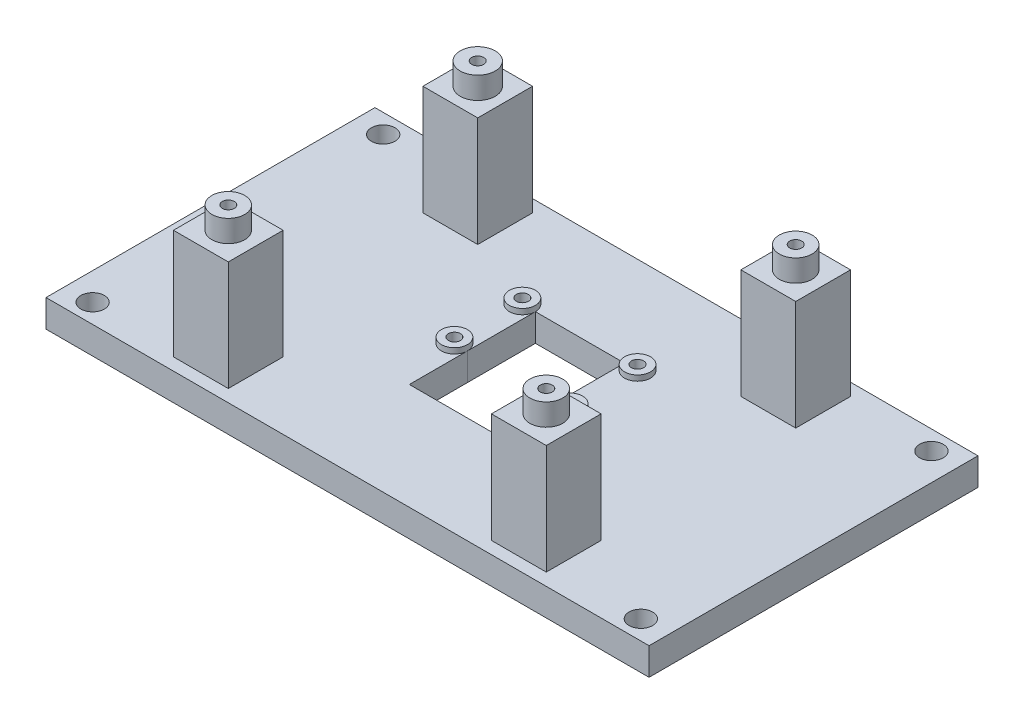
from build123d import *
from build123d.topology import SkipClean

# Parameters (mm, degrees)
ESQUISSE1_W             = 110
ESQUISSE1_H             = 60
BOSS_EXTRU_2_DEPTH      = 5
BOSS_EXTRU_3_START      = 1
ESQUISSE3_R             = 2.375
ESQUISSE3_R_2           = 1.1
BOSS_EXTRU_3_DEPTH      = 1
ESQUISSE4_W             = 5
ESQUISSE4_H             = 5
ESQUISSE4_W_2           = 10
ESQUISSE4_H_2           = 10
BOSS_EXTRU_4_DEPTH      = 20
ENL_V_MAT_EXTRU_5_DEPTH = 11
BOSS_EXTRU_5_START      = 4
BOSS_EXTRU_5_DEPTH      = 4
ENL_V_MAT_EXTRU_6_DEPTH = 10


with BuildPart() as part:
    # Esquisse1 → Boss.-Extru.2 (new body)
    # profile 1 of 22: a face of its own
    with BuildSketch(Plane(origin=(0, 0, 0), x_dir=(1, 0, 0), z_dir=(0, 1, 0))):
        Rectangle(ESQUISSE1_W, ESQUISSE1_H)
        with BuildLine():
            Line((-10.5, 2.375), (-10.5, 6.25))
            Line((-10.5, 6.25), (-10.5, 10.025))
            ThreePointArc((-10.5, 10.025), (-11.41471017, 10.208212988), (-12.188294627, 10.729585006))
            ThreePointArc((-12.188294627, 10.729585006), (-12.170414994, 14.088294627), (-8.811705373, 14.070414994))
            ThreePointArc((-8.811705373, 14.070414994), (-8.303374777, 13.303029695), (-8.125, 12.4))
            Line((-8.125, 12.4), (8.125, 12.4))
            ThreePointArc((8.125, 12.4), (8.345504143, 13.399386113), (8.966071665, 14.213198517))
            ThreePointArc((8.966071665, 14.213198517), (11.499386113, 14.554495857), (12.875, 12.4))
            ThreePointArc((12.875, 12.4), (12.654495857, 11.400613887), (12.033928335, 10.586801483))
            ThreePointArc((12.033928335, 10.586801483), (11.316785933, 10.169868672), (10.5, 10.025))
            Line((10.5, 10.025), (10.5, 2.375))
            ThreePointArc((10.5, 2.375), (11.368284246, 2.210589846), (12.116353968, 1.740122079))
            ThreePointArc((12.116353968, 1.740122079), (12.677092749, 0.949153393), (12.875, 0))
            ThreePointArc((12.875, 0), (11.449153393, -2.177092749), (8.883646032, -1.740122079))
            ThreePointArc((8.883646032, -1.740122079), (8.322907249, -0.949153387), (8.125, 1.1e-08))
            Line((8.125, 1.1e-08), (8.125, -10.6))
            Line((8.125, -10.6), (-8.125, -10.6))
            Line((-8.125, -10.6), (-8.125, 0))
            ThreePointArc((-8.125, 0), (-8.279774736, -0.843341435), (-8.723926127, -1.576764598))
            ThreePointArc((-8.723926127, -1.576764598), (-12.076764598, -1.776073873), (-12.276073873, 1.576764598))
            ThreePointArc((-12.276073873, 1.576764598), (-11.473603893, 2.166268788), (-10.5, 2.375))
        make_face(mode=Mode.SUBTRACT)
    # profile 2 of 22: a face of its own
    with BuildSketch(Plane(origin=(0, 0, 0), x_dir=(1, 0, 0), z_dir=(0, 1, 0))):
        with BuildLine():
            Line((-10.5, 6.25), (-8.125, 6.25))
            Line((-8.125, 6.25), (-8.125, 12.4))
            ThreePointArc((-8.125, 12.4), (-8.820621395, 10.720621395), (-10.5, 10.025))
            Line((-10.5, 10.025), (-10.5, 6.25))
        make_face()
    # profile 3 of 22: a face of its own
    with BuildSketch(Plane(origin=(0, 0, 0), x_dir=(1, 0, 0), z_dir=(0, 1, 0))):
        with BuildLine():
            Line((-8.125, 0), (-8.125, 6.25))
            Line((-8.125, 6.25), (-10.5, 6.25))
            Line((-10.5, 6.25), (-10.5, 2.375))
            ThreePointArc((-10.5, 2.375), (-8.820621395, 1.679378605), (-8.125, 0))
        make_face()
    # profile 4 of 22: a face of its own
    with BuildSketch(Plane(origin=(0, 0, 0), x_dir=(1, 0, 0), z_dir=(0, 1, 0))):
        with BuildLine():
            ThreePointArc((10.5, 10.025), (8.820621395, 10.720621395), (8.125, 12.4))
            Line((8.125, 12.4), (8.125, 1.1e-08))
            ThreePointArc((8.125, 1.1e-08), (8.820621399, 1.679378609), (10.5, 2.375))
            Line((10.5, 2.375), (10.5, 10.025))
        make_face()
    # profile 5 of 22: a face of its own
    with BuildSketch(Plane(origin=(0, 0, 0), x_dir=(1, 0, 0), z_dir=(0, 1, 0))):
        with BuildLine():
            Line((9.4, 12.4), (8.125, 12.4))
            ThreePointArc((8.125, 12.4), (8.820621395, 10.720621395), (10.5, 10.025))
            Line((10.5, 10.025), (10.5, 11.3))
            ThreePointArc((10.5, 11.3), (9.722182541, 11.622182541), (9.4, 12.4))
        make_face()
    # profile 6 of 22: a face of its own
    with BuildSketch(Plane(origin=(0, 0, 0), x_dir=(1, 0, 0), z_dir=(0, 1, 0))):
        with BuildLine():
            ThreePointArc((8.966071665, 14.213198517), (8.345504143, 13.399386113), (8.125, 12.4))
            Line((8.125, 12.4), (9.4, 12.4))
            ThreePointArc((9.4, 12.4), (9.502128235, 12.862873568), (9.789548982, 13.239797208))
            Line((9.789548982, 13.239797208), (8.966071665, 14.213198517))
        make_face()
    # profile 7 of 22: a face of its own
    with BuildSketch(Plane(origin=(0, 0, 0), x_dir=(1, 0, 0), z_dir=(0, 1, 0))):
        with BuildLine():
            ThreePointArc((12.875, 12.4), (11.499386113, 14.554495857), (8.966071665, 14.213198517))
            Line((8.966071665, 14.213198517), (9.789548982, 13.239797208))
            ThreePointArc((9.789548982, 13.239797208), (10.962873568, 13.397871765), (11.6, 12.4))
            ThreePointArc((11.6, 12.4), (11.497871765, 11.937126432), (11.210451018, 11.560202792))
            Line((11.210451018, 11.560202792), (12.033928335, 10.586801483))
            ThreePointArc((12.033928335, 10.586801483), (12.654495857, 11.400613887), (12.875, 12.4))
        make_face()
    # profile 8 of 22: a face of its own
    with BuildSketch(Plane(origin=(0, 0, 0), x_dir=(1, 0, 0), z_dir=(0, 1, 0))):
        with BuildLine():
            Line((10.5, 11.3), (10.5, 10.025))
            ThreePointArc((10.5, 10.025), (11.316785933, 10.169868672), (12.033928335, 10.586801483))
            Line((12.033928335, 10.586801483), (11.210451018, 11.560202792))
            ThreePointArc((11.210451018, 11.560202792), (10.878300853, 11.367097069), (10.5, 11.3))
        make_face()
    # profile 9 of 22: a face of its own
    with BuildSketch(Plane(origin=(0, 0, 0), x_dir=(1, 0, 0), z_dir=(0, 1, 0))):
        with BuildLine():
            Line((-9.718053015, 13.173665892), (-8.811705373, 14.070414994))
            ThreePointArc((-8.811705373, 14.070414994), (-12.170414994, 14.088294627), (-12.188294627, 10.729585006))
            Line((-12.188294627, 10.729585006), (-11.281946985, 11.626334108))
            ThreePointArc((-11.281946985, 11.626334108), (-11.515143458, 12.823655236), (-10.5, 13.5))
            ThreePointArc((-10.5, 13.5), (-10.076344764, 13.415143458), (-9.718053015, 13.173665892))
        make_face()
    # profile 10 of 22: a face of its own
    with BuildSketch(Plane(origin=(0, 0, 0), x_dir=(1, 0, 0), z_dir=(0, 1, 0))):
        with BuildLine():
            ThreePointArc((-12.188294627, 10.729585006), (-11.41471017, 10.208212988), (-10.5, 10.025))
            Line((-10.5, 10.025), (-10.5, 11.3))
            ThreePointArc((-10.5, 11.3), (-10.923655236, 11.384856542), (-11.281946985, 11.626334108))
            Line((-11.281946985, 11.626334108), (-12.188294627, 10.729585006))
        make_face()
    # profile 11 of 22: a face of its own
    with BuildSketch(Plane(origin=(0, 0, 0), x_dir=(1, 0, 0), z_dir=(0, 1, 0))):
        with BuildLine():
            ThreePointArc((-10.5, 10.025), (-8.820621395, 10.720621395), (-8.125, 12.4))
            Line((-8.125, 12.4), (-9.4, 12.4))
            ThreePointArc((-9.4, 12.4), (-9.722182541, 11.622182541), (-10.5, 11.3))
            Line((-10.5, 11.3), (-10.5, 10.025))
        make_face()
    # profile 12 of 22: a face of its own
    with BuildSketch(Plane(origin=(0, 0, 0), x_dir=(1, 0, 0), z_dir=(0, 1, 0))):
        with BuildLine():
            Line((-9.4, 12.4), (-8.125, 12.4))
            ThreePointArc((-8.125, 12.4), (-8.303374777, 13.303029695), (-8.811705373, 14.070414994))
            Line((-8.811705373, 14.070414994), (-9.718053015, 13.173665892))
            ThreePointArc((-9.718053015, 13.173665892), (-9.482615686, 12.818245333), (-9.4, 12.4))
        make_face()
    # profile 13 of 22: a face of its own
    with BuildSketch(Plane(origin=(0, 0, 0), x_dir=(1, 0, 0), z_dir=(0, 1, 0))):
        with BuildLine():
            ThreePointArc((-8.723926127, -1.576764598), (-8.279774736, -0.843341435), (-8.125, 0))
            ThreePointArc((-8.125, 0), (-8.820621395, 1.679378605), (-10.5, 2.375))
            Line((-10.5, 2.375), (-10.5, 1.1))
            ThreePointArc((-10.5, 1.1), (-9.722182541, 0.777817459), (-9.4, 0))
            ThreePointArc((-9.4, 0), (-9.471685141, -0.390600243), (-9.677397364, -0.730290972))
            Line((-9.677397364, -0.730290972), (-8.723926127, -1.576764598))
        make_face()
    # profile 14 of 22: a face of its own
    with BuildSketch(Plane(origin=(0, 0, 0), x_dir=(1, 0, 0), z_dir=(0, 1, 0))):
        with BuildLine():
            Line((-10.5, 1.1), (-10.5, 2.375))
            ThreePointArc((-10.5, 2.375), (-11.473603893, 2.166268788), (-12.276073873, 1.576764598))
            Line((-12.276073873, 1.576764598), (-11.322602636, 0.730290972))
            ThreePointArc((-11.322602636, 0.730290972), (-10.950932329, 1.003324491), (-10.5, 1.1))
        make_face()
    # profile 15 of 22: a face of its own
    with BuildSketch(Plane(origin=(0, 0, 0), x_dir=(1, 0, 0), z_dir=(0, 1, 0))):
        with BuildLine():
            ThreePointArc((-8.723926127, -1.576764598), (-8.279774736, -0.843341435), (-8.125, 0))
            ThreePointArc((-8.125, 0), (-8.820621395, 1.679378605), (-10.5, 2.375))
            Line((-10.5, 2.375), (-10.5, 1.1))
            ThreePointArc((-10.5, 1.1), (-9.722182541, 0.777817459), (-9.4, 0))
            ThreePointArc((-9.4, 0), (-9.471685141, -0.390600243), (-9.677397364, -0.730290972))
            Line((-9.677397364, -0.730290972), (-8.723926127, -1.576764598))
        make_face()
    # profile 16 of 22: a face of its own
    with BuildSketch(Plane(origin=(0, 0, 0), x_dir=(1, 0, 0), z_dir=(0, 1, 0))):
        with BuildLine():
            Line((-10.5, 1.1), (-10.5, 2.375))
            ThreePointArc((-10.5, 2.375), (-11.473603893, 2.166268788), (-12.276073873, 1.576764598))
            Line((-12.276073873, 1.576764598), (-11.322602636, 0.730290972))
            ThreePointArc((-11.322602636, 0.730290972), (-10.950932329, 1.003324491), (-10.5, 1.1))
        make_face()
    # profile 17 of 22: a face of its own
    with BuildSketch(Plane(origin=(0, 0, 0), x_dir=(1, 0, 0), z_dir=(0, 1, 0))):
        with BuildLine():
            ThreePointArc((-12.276073873, 1.576764598), (-12.076764598, -1.776073873), (-8.723926127, -1.576764598))
            Line((-8.723926127, -1.576764598), (-9.677397364, -0.730290972))
            ThreePointArc((-9.677397364, -0.730290972), (-10.049067671, -1.003324491), (-10.5, -1.1))
            ThreePointArc((-10.5, -1.1), (-11.503324491, -0.450932329), (-11.322602636, 0.730290972))
            Line((-11.322602636, 0.730290972), (-12.276073873, 1.576764598))
        make_face()
    # profile 18 of 22: a face of its own
    with BuildSketch(Plane(origin=(0, 0, 0), x_dir=(1, 0, 0), z_dir=(0, 1, 0))):
        with BuildLine():
            ThreePointArc((10.5, 2.375), (8.820621399, 1.679378609), (8.125, 1.1e-08))
            ThreePointArc((8.125, 1.1e-08), (8.322907249, -0.949153387), (8.883646032, -1.740122079))
            Line((8.883646032, -1.740122079), (9.751372899, -0.805951279))
            ThreePointArc((9.751372899, -0.805951279), (9.476147861, 0.402152703), (10.5, 1.1))
            Line((10.5, 1.1), (10.5, 2.375))
        make_face()
    # profile 19 of 22: a face of its own
    with BuildSketch(Plane(origin=(0, 0, 0), x_dir=(1, 0, 0), z_dir=(0, 1, 0))):
        with BuildLine():
            ThreePointArc((12.116353968, 1.740122079), (11.368284246, 2.210589846), (10.5, 2.375))
            Line((10.5, 2.375), (10.5, 1.1))
            ThreePointArc((10.5, 1.1), (10.902152703, 1.023852139), (11.248627101, 0.805951279))
            Line((11.248627101, 0.805951279), (12.116353968, 1.740122079))
        make_face()
    # profile 20 of 22: a face of its own
    with BuildSketch(Plane(origin=(0, 0, 0), x_dir=(1, 0, 0), z_dir=(0, 1, 0))):
        with BuildLine():
            ThreePointArc((10.5, 2.375), (8.820621399, 1.679378609), (8.125, 1.1e-08))
            ThreePointArc((8.125, 1.1e-08), (8.322907249, -0.949153387), (8.883646032, -1.740122079))
            Line((8.883646032, -1.740122079), (9.751372899, -0.805951279))
            ThreePointArc((9.751372899, -0.805951279), (9.476147861, 0.402152703), (10.5, 1.1))
            Line((10.5, 1.1), (10.5, 2.375))
        make_face()
    # profile 21 of 22: a face of its own
    with BuildSketch(Plane(origin=(0, 0, 0), x_dir=(1, 0, 0), z_dir=(0, 1, 0))):
        with BuildLine():
            ThreePointArc((12.116353968, 1.740122079), (11.368284246, 2.210589846), (10.5, 2.375))
            Line((10.5, 2.375), (10.5, 1.1))
            ThreePointArc((10.5, 1.1), (10.902152703, 1.023852139), (11.248627101, 0.805951279))
            Line((11.248627101, 0.805951279), (12.116353968, 1.740122079))
        make_face()
    # profile 22 of 22: a face of its own
    with BuildSketch(Plane(origin=(0, 0, 0), x_dir=(1, 0, 0), z_dir=(0, 1, 0))):
        with BuildLine():
            Line((9.751372899, -0.805951279), (8.883646032, -1.740122079))
            ThreePointArc((8.883646032, -1.740122079), (11.449153393, -2.177092749), (12.875, 0))
            ThreePointArc((12.875, 0), (12.677092749, 0.949153393), (12.116353968, 1.740122079))
            Line((12.116353968, 1.740122079), (11.248627101, 0.805951279))
            ThreePointArc((11.248627101, 0.805951279), (11.508337694, 0.439607887), (11.6, 0))
            ThreePointArc((11.6, 0), (11.277817459, -0.777817459), (10.5, -1.1))
            ThreePointArc((10.5, -1.1), (10.097847297, -1.023852139), (9.751372899, -0.805951279))
        make_face()
    extrude(amount=-BOSS_EXTRU_2_DEPTH)

    # Esquisse3 → Boss.-Extru.3 (add)
    # profile 1 of 4: a face of its own
    with SkipClean():  # the faces are left unmerged after this step: merging them gives an invalid solid
        with BuildSketch(Plane(origin=(0, 0, 0), x_dir=(1, 0, 0), z_dir=(0, 1, 0)).offset(BOSS_EXTRU_3_START)):
            with Locations((-10.5, 12.4)):
                Circle(ESQUISSE3_R)
            with Locations(Location((-10.5, 12.4, 0), (0, 0, 270))):
                Circle(ESQUISSE3_R_2, mode=Mode.SUBTRACT)
        # profile 2 of 4: a face of its own
        with BuildSketch(Plane(origin=(0, 0, 0), x_dir=(1, 0, 0), z_dir=(0, 1, 0)).offset(BOSS_EXTRU_3_START)):
            with Locations(Location((10.5, 12.4, 0), (0, 0, 180))):
                Circle(ESQUISSE3_R)
            with Locations(Location((10.5, 12.4, 0), (0, 0, 270))):
                Circle(ESQUISSE3_R_2, mode=Mode.SUBTRACT)
        # profile 3 of 4: a face of its own
        with BuildSketch(Plane(origin=(0, 0, 0), x_dir=(1, 0, 0), z_dir=(0, 1, 0)).offset(BOSS_EXTRU_3_START)):
            with Locations(Location((10.5, 0, 0), (0, 0, 180))):
                Circle(ESQUISSE3_R)
            with Locations(Location((10.5, 0, 0), (0, 0, 270))):
                Circle(ESQUISSE3_R_2, mode=Mode.SUBTRACT)
        # profile 4 of 4: a face of its own
        with BuildSketch(Plane(origin=(0, 0, 0), x_dir=(1, 0, 0), z_dir=(0, 1, 0)).offset(BOSS_EXTRU_3_START)):
            with Locations((-10.5, 0)):
                Circle(ESQUISSE3_R)
            with Locations(Location((-10.5, 0, 0), (0, 0, 270))):
                Circle(ESQUISSE3_R_2, mode=Mode.SUBTRACT)
        extrude(amount=-BOSS_EXTRU_3_DEPTH)

    # Esquisse4 → Boss.-Extru.4 (add)
    with SkipClean():  # the faces are left unmerged after this step: merging them gives an invalid solid
        with BuildSketch(Plane(origin=(0, 0, 0), x_dir=(1, 0, 0), z_dir=(0, 1, 0))):
            Polygon((-34, 27.75), (-34, 18.545454545), (-32.541666667, 17.75), (-29, 17.75), (-29, 22.75), (-24, 22.75), (-24, 27.75), align=None)
            with Locations((-26.5, 20.25)):
                Rectangle(ESQUISSE4_W, ESQUISSE4_H)
            Polygon((29, 22.75), (29, 17.75), (34, 17.75), (34, 27.75), (24, 27.75), (24, 22.75), align=None)
            with Locations((26.5, 20.25)):
                Rectangle(ESQUISSE4_W, ESQUISSE4_H)
            Polygon((34, -18.545454545), (32.541666667, -17.75), (29, -17.75), (29, -22.75), (24, -22.75), (24, -27.75), (34, -27.75), align=None)
            with Locations((26.5, -20.25)):
                Rectangle(ESQUISSE4_W, ESQUISSE4_H)
            Polygon((-32.541666667, 17.75), (-34, 18.545454545), (-34, 17.75), align=None)
            Polygon((34, -17.75), (32.541666667, -17.75), (34, -18.545454545), align=None)
            with Locations((-29, -22.75)):
                Rectangle(ESQUISSE4_W_2, ESQUISSE4_H_2)
        extrude(amount=BOSS_EXTRU_4_DEPTH)

    # Esquisse5 → Enlèv. mat.-Extru.5 (cut)
    with SkipClean():  # the faces are left unmerged after this step: merging them gives an invalid solid
        with BuildSketch(Plane(origin=(0, 20, 0), x_dir=(1, 0, 0), z_dir=(0, 1, 0))):
            with BuildLine():
                ThreePointArc((-28.461944876, 23.709425184), (-29.150388948, 23.839671127), (-29.777817459, 23.527817459))
                Line((-29.777817459, 23.527817459), (-29, 22.75))
                Line((-29, 22.75), (-28.461944876, 23.709425184))
            make_face()
            with BuildLine():
                Line((-29, 22.75), (-29.777817459, 23.527817459))
                ThreePointArc((-29.777817459, 23.527817459), (-30.089671127, 22.599611052), (-29.538055124, 21.790574816))
                Line((-29.538055124, 21.790574816), (-29, 22.75))
            make_face()
            with BuildLine():
                Line((-28.222182541, 21.972182541), (-29, 22.75))
                Line((-29, 22.75), (-29.538055124, 21.790574816))
                ThreePointArc((-29.538055124, 21.790574816), (-28.849611052, 21.660328873), (-28.222182541, 21.972182541))
            make_face()
            with BuildLine():
                Line((-28.461944876, 23.709425184), (-29, 22.75))
                Line((-29, 22.75), (-27.923806637, 22.97761337))
                ThreePointArc((-27.923806637, 22.97761337), (-28.113807766, 23.40166197), (-28.461944876, 23.709425184))
            make_face()
            with BuildLine():
                Line((-27.923806637, 22.97761337), (-29, 22.75))
                Line((-29, 22.75), (-28.222182541, 21.972182541))
                ThreePointArc((-28.222182541, 21.972182541), (-27.983732514, 22.329048224), (-27.9, 22.75))
                ThreePointArc((-27.9, 22.75), (-27.905967848, 22.864427491), (-27.923806637, 22.97761337))
            make_face()
            with BuildLine():
                ThreePointArc((29.598168514, 23.673143775), (28.884464852, 23.843915732), (28.222182541, 23.527817459))
                Line((28.222182541, 23.527817459), (29, 22.75))
                Line((29, 22.75), (29.598168514, 23.673143775))
            make_face()
            with BuildLine():
                Line((29, 22.75), (28.222182541, 23.527817459))
                ThreePointArc((28.222182541, 23.527817459), (27.906084268, 22.634464852), (28.401831486, 21.826856225))
                Line((28.401831486, 21.826856225), (29, 22.75))
            make_face()
            with BuildLine():
                Line((29.777817459, 21.972182541), (29, 22.75))
                Line((29, 22.75), (28.401831486, 21.826856225))
                ThreePointArc((28.401831486, 21.826856225), (29.115535148, 21.656084268), (29.777817459, 21.972182541))
            make_face()
            with BuildLine():
                Line((29.598168514, 23.673143775), (29, 22.75))
                Line((29, 22.75), (30.1, 22.75))
                ThreePointArc((30.1, 22.75), (29.966432968, 23.275363986), (29.598168514, 23.673143775))
            make_face()
            with BuildLine():
                Line((30.1, 22.75), (29, 22.75))
                Line((29, 22.75), (29.777817459, 21.972182541))
                ThreePointArc((29.777817459, 21.972182541), (30.016267486, 22.329048224), (30.1, 22.75))
            make_face()
            with BuildLine():
                ThreePointArc((29.220731384, -21.672374065), (28.683681325, -21.696461915), (28.222182541, -21.972182541))
                Line((28.222182541, -21.972182541), (29, -22.75))
                Line((29, -22.75), (29.220731384, -21.672374065))
            make_face()
            with BuildLine():
                Line((29.220731384, -21.672374065), (29, -22.75))
                Line((29, -22.75), (29.777817459, -23.527817459))
                ThreePointArc((29.777817459, -23.527817459), (30.016267486, -23.170951776), (30.1, -22.75))
                ThreePointArc((30.1, -22.75), (29.852292357, -22.05458808), (29.220731384, -21.672374065))
            make_face()
            with BuildLine():
                Line((29, -22.75), (28.222182541, -21.972182541))
                ThreePointArc((28.222182541, -21.972182541), (27.901313408, -22.80373799), (28.301801454, -23.600011053))
                Line((28.301801454, -23.600011053), (29, -22.75))
            make_face()
            with BuildLine():
                Line((29.777817459, -23.527817459), (29, -22.75))
                Line((29, -22.75), (28.301801454, -23.600011053))
                ThreePointArc((28.301801454, -23.600011053), (29.05373799, -23.848686592), (29.777817459, -23.527817459))
            make_face()
            with BuildLine():
                Line((-29, -22.75), (-29.777817459, -21.972182541))
                ThreePointArc((-29.777817459, -21.972182541), (-30.016267486, -22.329048224), (-30.1, -22.75))
                Line((-30.1, -22.75), (-29, -22.75))
            make_face()
            with BuildLine():
                ThreePointArc((-28.564411639, -21.739919419), (-29.206801181, -21.669614295), (-29.777817459, -21.972182541))
                Line((-29.777817459, -21.972182541), (-29, -22.75))
                Line((-29, -22.75), (-28.564411639, -21.739919419))
            make_face()
            with BuildLine():
                Line((-28.564411639, -21.739919419), (-29, -22.75))
                Line((-29, -22.75), (-28.222182541, -23.527817459))
                ThreePointArc((-28.222182541, -23.527817459), (-27.983732514, -23.170951776), (-27.9, -22.75))
                ThreePointArc((-27.9, -22.75), (-28.080993146, -22.145494912), (-28.564411639, -21.739919419))
            make_face()
            with BuildLine():
                Line((-28.222182541, -23.527817459), (-29, -22.75))
                Line((-29, -22.75), (-29.435588361, -23.760080581))
                ThreePointArc((-29.435588361, -23.760080581), (-28.793198819, -23.830385705), (-28.222182541, -23.527817459))
            make_face()
            with BuildLine():
                Line((-29.435588361, -23.760080581), (-29, -22.75))
                Line((-29, -22.75), (-30.1, -22.75))
                ThreePointArc((-30.1, -22.75), (-29.919006854, -23.354505088), (-29.435588361, -23.760080581))
            make_face()
        extrude(amount=-ENL_V_MAT_EXTRU_5_DEPTH, mode=Mode.SUBTRACT)

    # Esquisse6 → Boss.-Extru.5 (add)
    with SkipClean():  # the faces are left unmerged after this step: merging them gives an invalid solid
        with BuildSketch(Plane(origin=(0, 20, 0), x_dir=(1, 0, 0), z_dir=(0, 1, 0)).offset(BOSS_EXTRU_5_START)):
            with BuildLine():
                ThreePointArc((-25.812153773, 22.75), (-26.309120378, 24.459248498), (-27.645071812, 25.635573284))
                Line((-27.645071812, 25.635573284), (-28.532467723, 23.745697529))
                ThreePointArc((-28.532467723, 23.745697529), (-28.071483574, 23.339794242), (-27.9, 22.75))
                ThreePointArc((-27.9, 22.75), (-28.410205758, 21.821483574), (-29.467532277, 21.754302471))
                Line((-29.467532277, 21.754302471), (-30.354928188, 19.864426716))
                ThreePointArc((-30.354928188, 19.864426716), (-27.290751502, 20.059120378), (-25.812153773, 22.75))
            make_face()
            with BuildLine():
                Line((-28.532467723, 23.745697529), (-27.645071812, 25.635573284))
                ThreePointArc((-27.645071812, 25.635573284), (-31.885573284, 24.104928188), (-30.354928188, 19.864426716))
                Line((-30.354928188, 19.864426716), (-29.467532277, 21.754302471))
                ThreePointArc((-29.467532277, 21.754302471), (-29.995697529, 23.217532277), (-28.532467723, 23.745697529))
            make_face()
            with BuildLine():
                ThreePointArc((32, 22.75), (31.393168384, 24.559072991), (29.818169942, 25.636277524))
                Line((29.818169942, 25.636277524), (29.299995646, 23.808301759))
                ThreePointArc((29.299995646, 23.808301759), (29.877495074, 23.413326763), (30.1, 22.75))
                ThreePointArc((30.1, 22.75), (29.663326763, 21.872504926), (28.700004354, 21.691698241))
                Line((28.700004354, 21.691698241), (28.181830058, 19.863722476))
                ThreePointArc((28.181830058, 19.863722476), (30.809072991, 20.356831616), (32, 22.75))
            make_face()
            with BuildLine():
                Line((29.299995646, 23.808301759), (29.818169942, 25.636277524))
                ThreePointArc((29.818169942, 25.636277524), (26.113722476, 23.568169942), (28.181830058, 19.863722476))
                Line((28.181830058, 19.863722476), (28.700004354, 21.691698241))
                ThreePointArc((28.700004354, 21.691698241), (27.941698241, 23.049995646), (29.299995646, 23.808301759))
            make_face()
            with BuildLine():
                ThreePointArc((32, -22.75), (31.121320344, -20.628679656), (29, -19.75))
                Line((29, -19.75), (29, -21.65))
                ThreePointArc((29, -21.65), (29.777817459, -21.972182541), (30.1, -22.75))
                ThreePointArc((30.1, -22.75), (29.777817459, -23.527817459), (29, -23.85))
                Line((29, -23.85), (29, -25.75))
                ThreePointArc((29, -25.75), (31.121320344, -24.871320344), (32, -22.75))
            make_face()
            with BuildLine():
                Line((29, -21.65), (29, -19.75))
                ThreePointArc((29, -19.75), (26, -22.75), (29, -25.75))
                Line((29, -25.75), (29, -23.85))
                ThreePointArc((29, -23.85), (27.9, -22.75), (29, -21.65))
            make_face()
            with BuildLine():
                ThreePointArc((-26, -22.75), (-26.878679656, -20.628679656), (-29, -19.75))
                Line((-29, -19.75), (-29, -21.65))
                ThreePointArc((-29, -21.65), (-28.222182541, -21.972182541), (-27.9, -22.75))
                ThreePointArc((-27.9, -22.75), (-28.222182541, -23.527817459), (-29, -23.85))
                Line((-29, -23.85), (-29, -25.75))
                ThreePointArc((-29, -25.75), (-26.878679656, -24.871320344), (-26, -22.75))
            make_face()
            with BuildLine():
                Line((-29, -21.65), (-29, -19.75))
                ThreePointArc((-29, -19.75), (-32, -22.75), (-29, -25.75))
                Line((-29, -25.75), (-29, -23.85))
                ThreePointArc((-29, -23.85), (-30.1, -22.75), (-29, -21.65))
            make_face()
        extrude(amount=-BOSS_EXTRU_5_DEPTH)

    # Esquisse7 → Enlèv. mat.-Extru.6 (cut)
    with SkipClean():  # the faces are left unmerged after this step: merging them gives an invalid solid
        with BuildSketch(Plane(origin=(0, 0, 0), x_dir=(1, 0, 0), z_dir=(0, 1, 0))):
            with BuildLine():
                ThreePointArc((-50, 28.65), (-51.52027958, 28.02027958), (-52.15, 26.5))
                Line((-52.15, 26.5), (-50, 26.5))
                Line((-50, 26.5), (-50, 28.65))
            make_face()
            with BuildLine():
                ThreePointArc((-47.85, 26.5), (-48.47972042, 28.02027958), (-50, 28.65))
                Line((-50, 28.65), (-50, 26.5))
                Line((-50, 26.5), (-47.85, 26.5))
            make_face()
            with BuildLine():
                Line((-50, 26.5), (-52.15, 26.5))
                ThreePointArc((-52.15, 26.5), (-50, 24.35), (-47.85, 26.5))
                Line((-47.85, 26.5), (-50, 26.5))
            make_face()
            with BuildLine():
                ThreePointArc((-47.85, -26.5), (-50, -24.35), (-52.15, -26.5))
                Line((-52.15, -26.5), (-50, -26.5))
                Line((-50, -26.5), (-47.85, -26.5))
            make_face()
            with BuildLine():
                Line((-50, -26.5), (-50, -28.65))
                ThreePointArc((-50, -28.65), (-48.47972042, -28.02027958), (-47.85, -26.5))
                Line((-47.85, -26.5), (-50, -26.5))
            make_face()
            with BuildLine():
                Line((-50, -26.5), (-52.15, -26.5))
                ThreePointArc((-52.15, -26.5), (-51.52027958, -28.02027958), (-50, -28.65))
                Line((-50, -28.65), (-50, -26.5))
            make_face()
            with BuildLine():
                Line((50, -26.5), (52.15, -26.5))
                ThreePointArc((52.15, -26.5), (50, -24.35), (47.85, -26.5))
                Line((47.85, -26.5), (50, -26.5))
            make_face()
            with BuildLine():
                ThreePointArc((47.85, -26.5), (48.47972042, -28.02027958), (50, -28.65))
                Line((50, -28.65), (50, -26.5))
                Line((50, -26.5), (47.85, -26.5))
            make_face()
            with BuildLine():
                Line((50, -26.5), (50, -28.65))
                ThreePointArc((50, -28.65), (51.52027958, -28.02027958), (52.15, -26.5))
                Line((52.15, -26.5), (50, -26.5))
            make_face()
            with BuildLine():
                ThreePointArc((52.15, 26.5), (51.52027958, 28.02027958), (50, 28.65))
                Line((50, 28.65), (50, 26.5))
                Line((50, 26.5), (52.15, 26.5))
            make_face()
            with BuildLine():
                Line((50, 26.5), (50, 28.65))
                ThreePointArc((50, 28.65), (48.47972042, 28.02027958), (47.85, 26.5))
                Line((47.85, 26.5), (50, 26.5))
            make_face()
            with BuildLine():
                ThreePointArc((47.85, 26.5), (50, 24.35), (52.15, 26.5))
                Line((52.15, 26.5), (50, 26.5))
                Line((50, 26.5), (47.85, 26.5))
            make_face()
        extrude(amount=-ENL_V_MAT_EXTRU_6_DEPTH, mode=Mode.SUBTRACT)


solid = part.part
